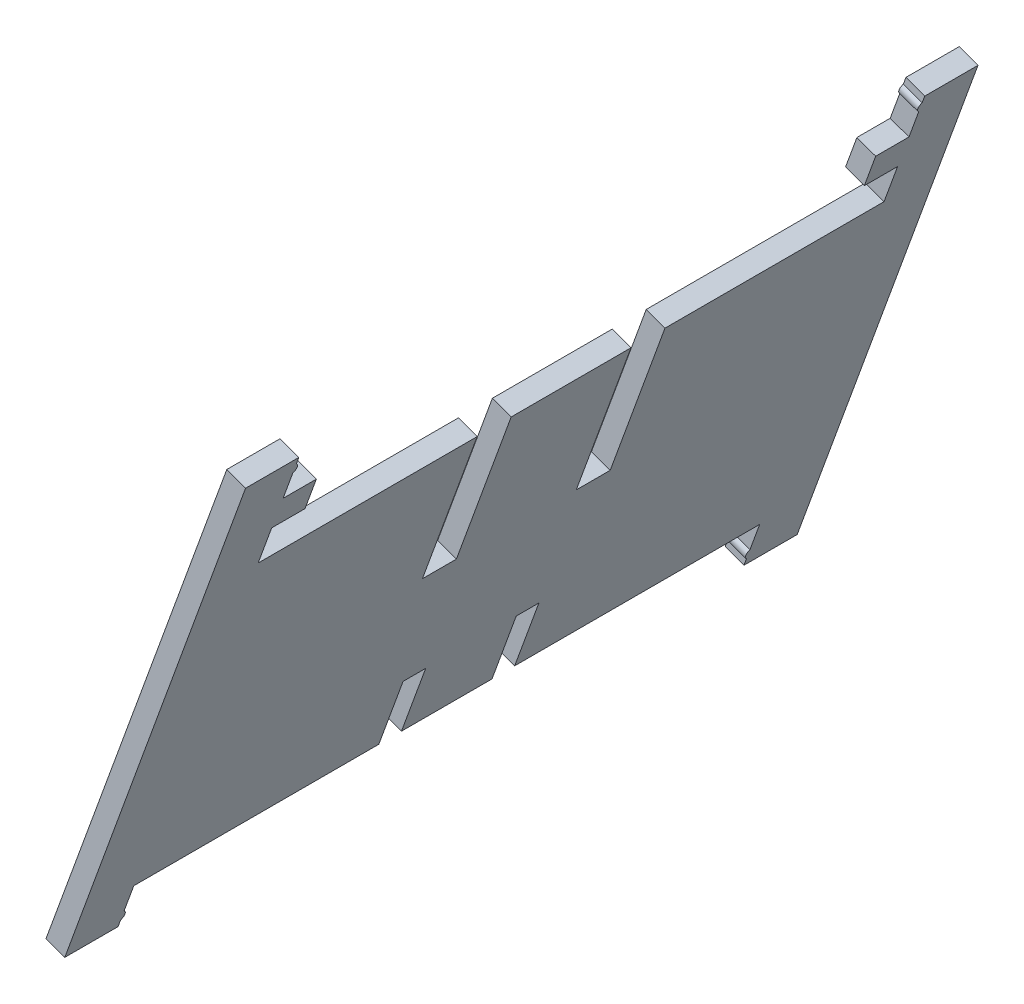
from build123d import *

# Parameters (mm, degrees)
BOSS_EXTRUDE1_DEPTH       = 55
TOP_TAB_NOTCH_REACH       = 197.475
BOTTOM_TAB_NOTCH_REACH    = 197.475
BOTTOM_CENTER_SLOTS_REACH = 197.475
SKETCH6_W                 = 3.4
SKETCH6_H                 = 10.641777725


with BuildPart() as part:
    # Sketch1 → Boss-Extrude1 (new, symmetric)
    with BuildSketch(Plane.XY):
        Polygon((-44.702851081, 214.841310922), (-71.856111855, 140.238340079), (-69.037033993, 139.212279649), (-41.883773219, 213.815250492), align=None)
    extrude(amount=BOSS_EXTRUDE1_DEPTH, both=True)

    # Sketch3 → top tab notch (cut, up to next)
    with BuildSketch(Plane(origin=(-108.522277226, 39.498878665, 0), x_dir=(0, 0, 1), z_dir=(-0.9396926207859095, 0.34202014332566577, 0)), mode=Mode.PRIVATE) as top_tab_notch_sk1:
        with BuildLine():
            Line((47, 186.595518979), (-47, 186.595518979))
            Line((-47, 186.595518979), (-47, 185.462807478))
            ThreePointArc((-47, 185.462807478), (-46.6, 184.712807478), (-47, 183.962807478))
            Line((-47, 183.962807478), (-47, 179.678363458))
            Line((-47, 179.678363458), (-42, 179.678363458))
            Line((-42, 179.678363458), (-42, 174.678363458))
            Line((-42, 174.678363458), (-47, 174.678363458))
            Line((-47, 174.678363458), (-47, 168.728030606))
            Line((-47, 168.728030606), (-14.1, 168.728030606))
            Line((-14.1, 168.728030606), (-14.1, 144.678363458))
            Line((-14.1, 144.678363458), (-9, 144.678363458))
            Line((-9, 144.678363458), (-9, 168.728030606))
            Line((-9, 168.728030606), (9, 168.728030606))
            Line((9, 168.728030606), (9, 144.678363458))
            Line((9, 144.678363458), (14.1, 144.678363458))
            Line((14.1, 144.678363458), (14.1, 168.728030606))
            Line((14.1, 168.728030606), (47, 168.728030606))
            Line((47, 168.728030606), (47, 174.678363458))
            Line((47, 174.678363458), (42, 174.678363458))
            Line((42, 174.678363458), (42, 179.678363458))
            Line((42, 179.678363458), (47, 179.678363458))
            Line((47, 179.678363458), (47, 183.962807478))
            ThreePointArc((47, 183.962807478), (46.6, 184.712807478), (47, 185.462807478))
            Line((47, 185.462807478), (47, 186.595518979))
        make_face()
    top_tab_notch_tool1 = extrude(top_tab_notch_sk1.sketch, amount=-TOP_TAB_NOTCH_REACH, mode=Mode.PRIVATE) & part.part
    add(top_tab_notch_tool1.solids().sort_by_distance((-48.693367, 203.877457, 0))[0], mode=Mode.SUBTRACT)

    # Sketch5 → bottom tab notch (cut, up to next)
    with BuildSketch(Plane(origin=(-108.522277226, 39.498878665, 0), x_dir=(0, 0, 1), z_dir=(-0.9396926207859096, 0.34202014332566527, 0)), mode=Mode.PRIVATE) as bottom_tab_notch_sk1:
        with BuildLine():
            Line((47, 107.204695648), (47, 108.337407149))
            ThreePointArc((47, 108.337407149), (46.6, 109.087407149), (47, 109.837407149))
            Line((47, 109.837407149), (47, 114.121851169))
            Line((47, 114.121851169), (-47, 114.121851169))
            Line((-47, 114.121851169), (-47, 109.837407149))
            ThreePointArc((-47, 109.837407149), (-46.6, 109.087407149), (-47, 108.337407149))
            Line((-47, 108.337407149), (-47, 107.204695648))
            Line((-47, 107.204695648), (47, 107.204695648))
        make_face()
    bottom_tab_notch_tool1 = extrude(bottom_tab_notch_sk1.sketch, amount=-BOTTOM_TAB_NOTCH_REACH, mode=Mode.PRIVATE) & part.part
    add(bottom_tab_notch_tool1.solids().sort_by_distance((-70.672508, 143.490264, 0))[0], mode=Mode.SUBTRACT)

    # Sketch6 → bottom center slots (cut, up to next)
    with BuildSketch(Plane(origin=(-108.522277226, 39.498878665, 0), x_dir=(0, 0, 1), z_dir=(-0.9396926207859096, 0.34202014332566527, 0)), mode=Mode.PRIVATE) as bottom_center_slots_sk1:
        with Locations((8.5, 119.442740032)):
            Rectangle(SKETCH6_W, SKETCH6_H)
    bottom_center_slots_tool1 = extrude(bottom_center_slots_sk1.sketch, amount=-BOTTOM_CENTER_SLOTS_REACH, mode=Mode.PRIVATE) & part.part
    # Sketch6 → bottom center slots (cut, up to next)
    with BuildSketch(Plane(origin=(-108.522277226, 39.498878665, 0), x_dir=(0, 0, 1), z_dir=(-0.9396926207859096, 0.34202014332566527, 0)), mode=Mode.PRIVATE) as bottom_center_slots_sk2:
        with Locations((-8.5, 119.442740032)):
            Rectangle(SKETCH6_W, SKETCH6_H)
    bottom_center_slots_tool2 = extrude(bottom_center_slots_sk2.sketch, amount=-BOTTOM_CENTER_SLOTS_REACH, mode=Mode.PRIVATE) & part.part
    add(bottom_center_slots_tool1.solids().sort_by_distance((-67.670454, 151.73834, 8.5))[0], mode=Mode.SUBTRACT)
    add(bottom_center_slots_tool2.solids().sort_by_distance((-67.670454, 151.73834, -8.5))[0], mode=Mode.SUBTRACT)


solid = part.part
